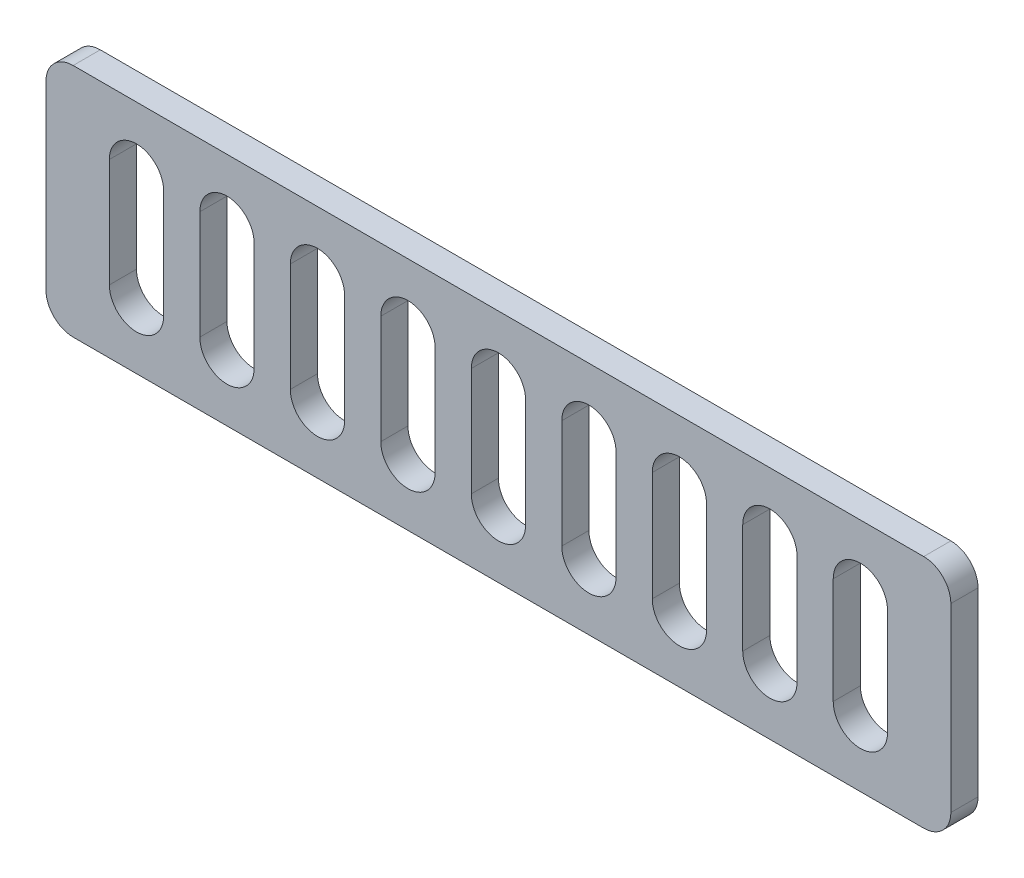
from build123d import *

# Parameters (mm, degrees)
SKETCH1_W           = 100
SKETCH1_H           = 26
BOSS_EXTRUDE1_DEPTH = 3
FILLET1_R           = 3


with BuildPart() as part:
    # Sketch1 → Boss-Extrude1 (new body)
    with BuildSketch(Plane.XY):
        with Locations((-69.498894811, -94.401018189)):
            Rectangle(SKETCH1_W, SKETCH1_H)
        with BuildLine():
            Line((-66.498894811, -88.401018189), (-66.498894811, -100.401018189))
            ThreePointArc((-66.498894811, -100.401018189), (-69.498894811, -103.401018189), (-72.498894811, -100.401018189))
            Line((-72.498894811, -100.401018189), (-72.498894811, -88.401018189))
            ThreePointArc((-72.498894811, -88.401018189), (-69.498894811, -85.401018189), (-66.498894811, -88.401018189))
        make_face(mode=Mode.SUBTRACT)
        with BuildLine():
            Line((-106.498894811, -88.401018189), (-106.498894811, -100.401018189))
            ThreePointArc((-106.498894811, -100.401018189), (-109.498894811, -103.401018189), (-112.498894811, -100.401018189))
            Line((-112.498894811, -100.401018189), (-112.498894811, -88.401018189))
            ThreePointArc((-112.498894811, -88.401018189), (-109.498894811, -85.401018189), (-106.498894811, -88.401018189))
        make_face(mode=Mode.SUBTRACT)
        with BuildLine():
            Line((-96.498894811, -88.401018189), (-96.498894811, -100.401018189))
            ThreePointArc((-96.498894811, -100.401018189), (-99.498894811, -103.401018189), (-102.498894811, -100.401018189))
            Line((-102.498894811, -100.401018189), (-102.498894811, -88.401018189))
            ThreePointArc((-102.498894811, -88.401018189), (-99.498894811, -85.401018189), (-96.498894811, -88.401018189))
        make_face(mode=Mode.SUBTRACT)
        with BuildLine():
            Line((-86.498894811, -88.401018189), (-86.498894811, -100.401018189))
            ThreePointArc((-86.498894811, -100.401018189), (-89.498894811, -103.401018189), (-92.498894811, -100.401018189))
            Line((-92.498894811, -100.401018189), (-92.498894811, -88.401018189))
            ThreePointArc((-92.498894811, -88.401018189), (-89.498894811, -85.401018189), (-86.498894811, -88.401018189))
        make_face(mode=Mode.SUBTRACT)
        with BuildLine():
            Line((-76.498894811, -88.401018189), (-76.498894811, -100.401018189))
            ThreePointArc((-76.498894811, -100.401018189), (-79.498894811, -103.401018189), (-82.498894811, -100.401018189))
            Line((-82.498894811, -100.401018189), (-82.498894811, -88.401018189))
            ThreePointArc((-82.498894811, -88.401018189), (-79.498894811, -85.401018189), (-76.498894811, -88.401018189))
        make_face(mode=Mode.SUBTRACT)
        with BuildLine():
            Line((-56.498894811, -88.401018189), (-56.498894811, -100.401018189))
            ThreePointArc((-56.498894811, -100.401018189), (-59.498894811, -103.401018189), (-62.498894811, -100.401018189))
            Line((-62.498894811, -100.401018189), (-62.498894811, -88.401018189))
            ThreePointArc((-62.498894811, -88.401018189), (-59.498894811, -85.401018189), (-56.498894811, -88.401018189))
        make_face(mode=Mode.SUBTRACT)
        with BuildLine():
            Line((-46.498894811, -88.355569142), (-46.498894811, -100.446467236))
            ThreePointArc((-46.498894811, -100.446467236), (-49.498894811, -103.446467236), (-52.498894811, -100.446467236))
            Line((-52.498894811, -100.446467236), (-52.498894811, -88.355569142))
            ThreePointArc((-52.498894811, -88.355569142), (-49.498894811, -85.355569142), (-46.498894811, -88.355569142))
        make_face(mode=Mode.SUBTRACT)
        with BuildLine():
            Line((-36.498894811, -88.346498653), (-36.498894811, -100.455537725))
            ThreePointArc((-36.498894811, -100.455537725), (-39.498894811, -103.455537725), (-42.498894811, -100.455537725))
            Line((-42.498894811, -100.455537725), (-42.498894811, -88.346498653))
            ThreePointArc((-42.498894811, -88.346498653), (-39.498894811, -85.346498653), (-36.498894811, -88.346498653))
        make_face(mode=Mode.SUBTRACT)
        with BuildLine():
            Line((-26.498894811, -88.531064652), (-26.498894811, -100.270971726))
            ThreePointArc((-26.498894811, -100.270971726), (-29.498894811, -103.270971726), (-32.498894811, -100.270971726))
            Line((-32.498894811, -100.270971726), (-32.498894811, -88.531064652))
            ThreePointArc((-32.498894811, -88.531064652), (-29.498894811, -85.531064652), (-26.498894811, -88.531064652))
        make_face(mode=Mode.SUBTRACT)
    extrude(amount=-BOSS_EXTRUDE1_DEPTH)

    # Fillet1
    fillet1_edges = [part.edges().sort_by_distance(p)[0] for p in [
        (-119.498894811, -81.401018189, -1.5),
        (-19.498894811, -81.401018189, -1.5),
        (-19.498894811, -107.401018189, -1.5),
        (-119.498894811, -107.401018189, -1.5),
    ]]
    fillet(fillet1_edges, radius=FILLET1_R)


solid = part.part
